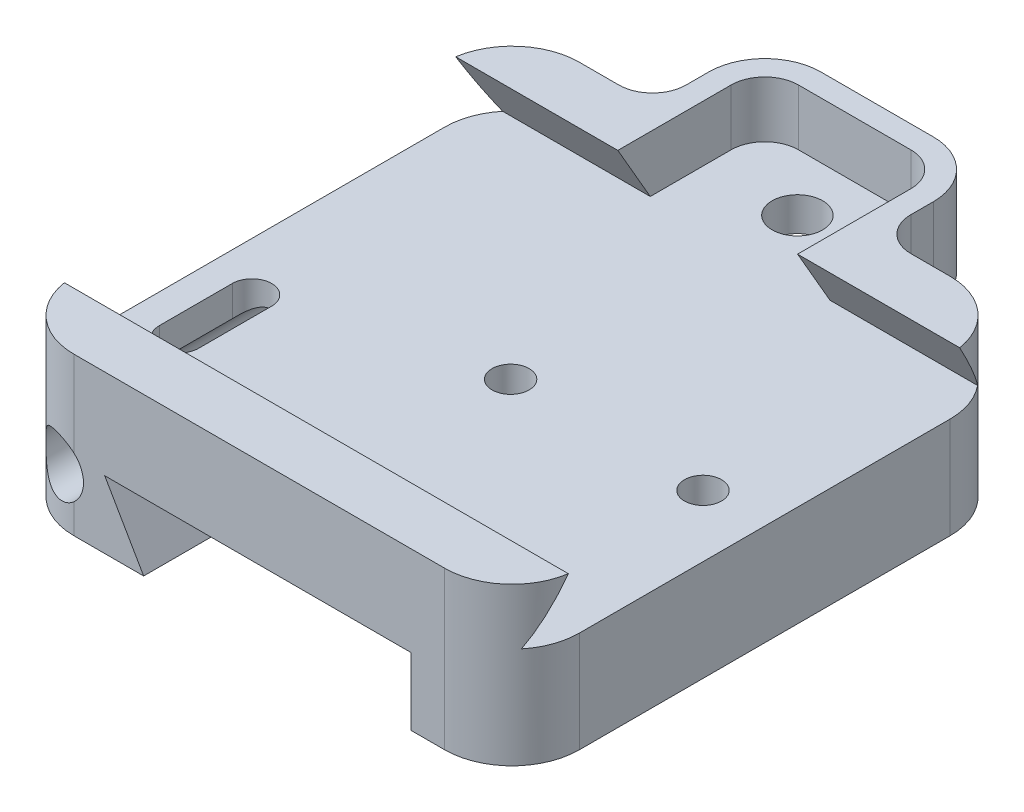
from build123d import *

# Parameters (mm, degrees)
SKETCH_1_W               = 45
SKETCH_1_H               = 45
EXTRUDE_1_DEPTH          = 16
CUT_EXTRUDE_1_DEPTH      = 66.620118866
SKETCH_3_W               = 13.364101615
SKETCH_3_H               = 45
CUT_EXTRUDE_2_DEPTH      = 8
CUT_EXTRUDE_3_REACH      = 67.62
FILLET_1_R               = 6
F_2MM_W                  = 50.544050544
F_2MM_H                  = 52.749609113
CUT_EXTRUDE_4_DEPTH      = 2
EXTRUDE_2_DEPTH          = 6
SKETCH_6_R               = 2.5
CUT_EXTRUDE_5_DEPTH      = 30
EXTRUDE_3_DEPTH          = 2
SKETCH_9_W               = 20
SKETCH_9_H               = 10
EXTRUDE_4_DEPTH          = 8
FILLET_2_R               = 5
CUT_EXTRUDE_6_DEPTH      = 5
FILLET_3_R               = 3
HOLE_WIZARD_M41_D        = 4.5
M4X0_71_D                = 3.3
CUT_EXTRUDE_7_REACH      = 73.631
CUT_EXTRUDE_7_END_RADIUS = 2.5
M4X0_72_D                = 3.3


with BuildPart() as part:
    # Эскиз1 → Бобышка-Вытянуть1 (new body)
    with BuildSketch(Plane(origin=(0, 0, 0), x_dir=(1, 0, 0), z_dir=(0, 1, 0))):
        with Locations((22.5, 22.5)):
            Rectangle(SKETCH_1_W, SKETCH_1_H)
    extrude(amount=EXTRUDE_1_DEPTH)

    # Эскиз2 → Вырез-Вытянуть1 (cut, through all)
    with BuildSketch(Plane.XY):
        Polygon((8.745299462, 8), (36.254700538, 8), (31.635898385, 0), (13.364101615, 0), align=None)
    extrude(amount=-CUT_EXTRUDE_1_DEPTH, mode=Mode.SUBTRACT)

    # Эскиз3 → Вырез-Вытянуть2 (cut)
    with BuildSketch(Plane.XZ):
        with Locations((38.317949193, -22.5)):
            Rectangle(SKETCH_3_W, SKETCH_3_H)
    extrude(amount=-CUT_EXTRUDE_2_DEPTH, mode=Mode.SUBTRACT)

    # Эскиз4 → Вырез-Вытянуть3 (cut, up to next)
    with BuildSketch(Plane(origin=(45, 0, 0), x_dir=(0, 0, -1), z_dir=(1, 0, 0)), mode=Mode.PRIVATE) as cut_extrude_3_sk1:
        Polygon((5.082050808, 16), (2.195299462, 11), (42.804700538, 11), (39.917949192, 16), align=None)
    cut_extrude_3_tool1 = extrude(cut_extrude_3_sk1.sketch, amount=-CUT_EXTRUDE_3_REACH, mode=Mode.PRIVATE) & part.part
    add(cut_extrude_3_tool1.solids().sort_by_distance((45, 13.436229, -22.5))[0], mode=Mode.SUBTRACT)

    # Скругление1
    fillet_1_edges = [part.edges().sort_by_distance(p)[0] for p in [
        (0, 8, -45),
        (45, 12, -45),
        (45, 12, 0),
        (0, 8, 0),
    ]]
    fillet(fillet_1_edges, radius=FILLET_1_R)

    # -2mm → Вырез-Вытянуть4 (cut)
    with BuildSketch(Plane.XZ):
        with Locations((21.76481381, -22.637847411)):
            Rectangle(F_2MM_W, F_2MM_H)
    extrude(amount=-CUT_EXTRUDE_4_DEPTH, mode=Mode.SUBTRACT)

    # Эскиз7 → Бобышка-Вытянуть2 (add)
    with BuildSketch(Plane.XZ.offset(-8)):
        with BuildLine():
            Line((43, -39), (43, -6))
            ThreePointArc((43, -6), (41.828427125, -3.171572875), (39, -2))
            Line((39, -2), (36, -2))
            Line((36, -2), (36, 0))
            Line((36, 0), (39, 0))
            ThreePointArc((39, 0), (43.242640687, -1.757359313), (45, -6))
            Line((45, -6), (45, -39))
            ThreePointArc((45, -39), (43.242640687, -43.242640687), (39, -45))
            Line((39, -45), (36, -45))
            Line((36, -45), (36, -43))
            Line((36, -43), (39, -43))
            ThreePointArc((39, -43), (41.828427125, -41.828427125), (43, -39))
        make_face()
    extrude(amount=EXTRUDE_2_DEPTH)

    # Эскиз6 → Вырез-Вытянуть5 (cut)
    with BuildSketch(Plane.XY):
        with Locations((4.352411604, 6.5)):
            Circle(SKETCH_6_R)
    extrude(amount=-CUT_EXTRUDE_5_DEPTH, mode=Mode.SUBTRACT)

    # Эскиз8 → Бобышка-Вытянуть3 (add)
    with BuildSketch(Plane.XZ.offset(-8)):
        with BuildLine():
            Line((36, -2), (39, -2))
            ThreePointArc((39, -2), (41.828427125, -3.171572875), (43, -6))
            Line((43, -6), (43, -39))
            ThreePointArc((43, -39), (41.828427125, -41.828427125), (39, -43))
            Line((39, -43), (36, -43))
            Line((36, -43), (36, -2))
        make_face()
    extrude(amount=EXTRUDE_3_DEPTH)

    # Эскиз9 → Бобышка-Вытянуть4 (add)
    with BuildSketch(Plane(origin=(0, 16, 0), x_dir=(1, 0, 0), z_dir=(0, 1, 0))):
        with Locations((22.5, 50)):
            Rectangle(SKETCH_9_W, SKETCH_9_H)
    extrude(amount=-EXTRUDE_4_DEPTH)

    # Скругление2
    fillet_2_edges = [part.edges().sort_by_distance(p)[0] for p in [
        (32.5, 12, -55),
        (12.5, 12, -55),
    ]]
    fillet(fillet_2_edges, radius=FILLET_2_R)

    # Эскиз10 → Вырез-Вытянуть6 (cut)
    with BuildSketch(Plane(origin=(0, 16, 0), x_dir=(1, 0, 0), z_dir=(0, 1, 0))):
        with BuildLine():
            Line((14.5, 50), (14.5, 39.917949192))
            Line((14.5, 39.917949192), (30.5, 39.917949192))
            Line((30.5, 39.917949192), (30.5, 50))
            ThreePointArc((30.5, 50), (29.621320344, 52.121320344), (27.5, 53))
            Line((27.5, 53), (17.5, 53))
            ThreePointArc((17.5, 53), (15.378679656, 52.121320344), (14.5, 50))
        make_face()
    extrude(amount=-CUT_EXTRUDE_6_DEPTH, mode=Mode.SUBTRACT)

    # Скругление3
    fillet_3_edges = [part.edges().sort_by_distance(p)[0] for p in [
        (32.5, 12, -45),
        (12.5, 12, -45),
    ]]
    fillet(fillet_3_edges, radius=FILLET_3_R)

    # Отверстие с зазором M41 (through all)
    with Locations(Plane(origin=(0, 11, 0), x_dir=(1, 0, 0), z_dir=(0, 1, 0))):
        with Locations((22.5, 47.902350269)):
            Hole(HOLE_WIZARD_M41_D / 2)

    # Отверстие обработанное метчиком M4x0.71 (through all)
    with Locations(Plane(origin=(0, 6, 0), x_dir=(-1, 0, 0), z_dir=(0, -1, 0))):
        with Locations((-39.5, 22.5)):
            Hole(M4X0_71_D / 2)

    # Вырез-Вытянуть7: up to this cylinder (the profile starts outside it)
    cut_extrude_7_end = Plane(origin=(4.352411604, 6.5, -14.25), z_dir=(0, 0, 1)) * Cylinder(CUT_EXTRUDE_7_END_RADIUS, 153.262, mode=Mode.PRIVATE)
    # Эскиз17 → Вырез-Вытянуть7 (cut, up to the surface)
    with BuildSketch(Plane(origin=(0, 11, 0), x_dir=(1, 0, 0), z_dir=(0, 1, 0)), mode=Mode.PRIVATE) as cut_extrude_7_sk1:
        with BuildLine():
            Line((6.102411604, 17.5), (6.102411604, 11))
            ThreePointArc((6.102411604, 11), (4.352411604, 9.25), (2.602411604, 11))
            Line((2.602411604, 11), (2.602411604, 17.5))
            ThreePointArc((2.602411604, 17.5), (4.352411604, 19.25), (6.102411604, 17.5))
        make_face()
    cut_extrude_7_tool1 = extrude(cut_extrude_7_sk1.sketch, amount=-CUT_EXTRUDE_7_REACH, mode=Mode.PRIVATE) - cut_extrude_7_end
    add(cut_extrude_7_tool1.solids().sort_by_distance((4.352412, 11, -14.25))[0], mode=Mode.SUBTRACT)

    # Отверстие обработанное метчиком M4x0.72 (through all)
    with Locations(Plane(origin=(0, 8, 0), x_dir=(-1, 0, 0), z_dir=(0, -1, 0))):
        with Locations((-22.372649731, 22.5)):
            Hole(M4X0_72_D / 2)


solid = part.part
